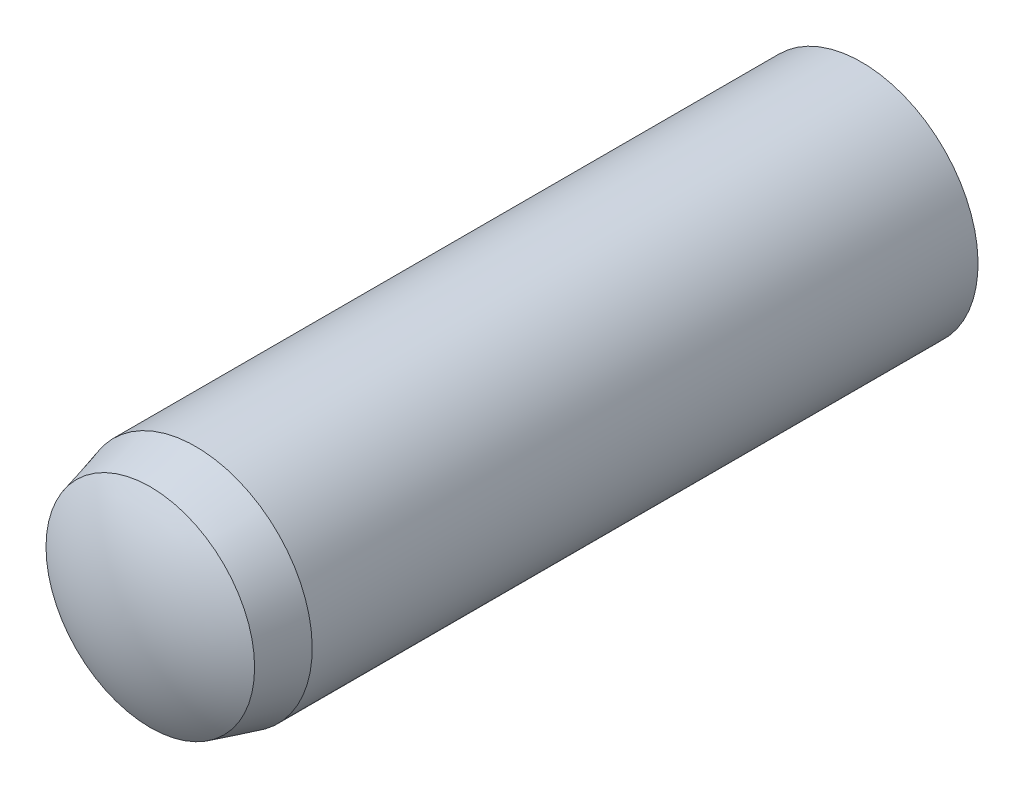
from build123d import *


with BuildPart() as part:
    # Sketch3 → Revolve1 (revolve)
    with BuildSketch(Plane(origin=(0, 0, 0), x_dir=(0, 0, -1), z_dir=(1, 0, 0)), mode=Mode.PRIVATE) as revolve1_sk:
        with BuildLine():
            Line((-5, 0), (5, 0))
            ThreePointArc((5, 0), (4.885076627, 0.783022988), (4.55, 1.5))
            Line((4.55, 1.5), (-4.025, 1.5))
            Line((-4.025, 1.5), (-4.61, 1.343249722))
            ThreePointArc((-4.61, 1.343249722), (-4.90052754, 0.699360389), (-5, 0))
        make_face()
    revolve(revolve1_sk.sketch.rotate(Axis((0, 0, 5), (0, 0, -1)), 180), axis=Axis((0, 0, 5), (0, 0, -1)))


solid = part.part
